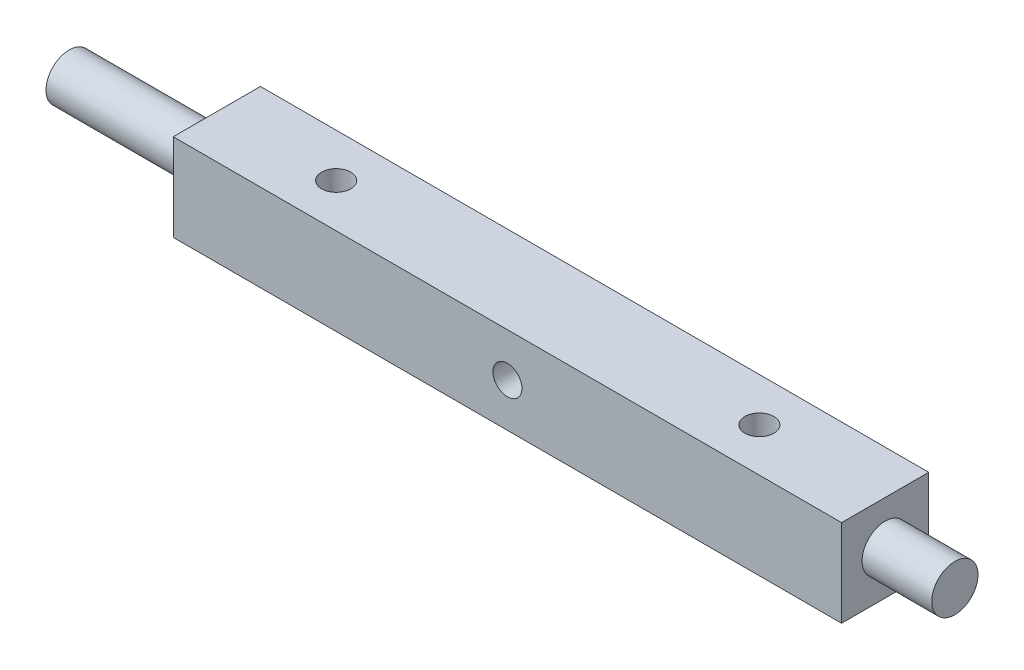
from build123d import *

# Parameters (mm, degrees)
CROQUIS1_W              = 15
CROQUIS1_H              = 15
SALIENTE_EXTRUIR1_DEPTH = 57.5
CROQUIS2_R              = 2.5
CORTAR_EXTRUIR1_DEPTH   = 60.895742754
CROQUIS3_R              = 2.5
CORTAR_EXTRUIR2_DEPTH   = 60.895742754
CROQUIS4_R              = 4
SALIENTE_EXTRUIR2_DEPTH = 25.4
CROQUIS5_R              = 3.976569184
SALIENTE_EXTRUIR3_DEPTH = 12


with BuildPart() as part:
    # Croquis1 → Saliente-Extruir1 (new, symmetric)
    with BuildSketch(Plane(origin=(0, 0, 0), x_dir=(0, 0, -1), z_dir=(1, 0, 0))):
        Rectangle(CROQUIS1_W, CROQUIS1_H)
    extrude(amount=SALIENTE_EXTRUIR1_DEPTH, both=True)

    # Croquis2 → Cortar-Extruir1 (cut, through all)
    with BuildSketch(Plane.XY.offset(7.5)):
        Circle(CROQUIS2_R)
    extrude(amount=-CORTAR_EXTRUIR1_DEPTH, mode=Mode.SUBTRACT)

    # Croquis3 → Cortar-Extruir2 (cut, through all)
    with BuildSketch(Plane(origin=(0, 7.5, 0), x_dir=(1, 0, 0), z_dir=(0, 1, 0))):
        with Locations(Location((-36.974332256, 0, 0), (0, 0, 270))):
            Circle(CROQUIS3_R)
        with Locations(Location((35.85631789, 0, 0), (0, 0, 270))):
            Circle(CROQUIS3_R)
    extrude(amount=-CORTAR_EXTRUIR2_DEPTH, mode=Mode.SUBTRACT)

    # Croquis4 → Saliente-Extruir2 (add)
    with BuildSketch(Plane.ZY.offset(57.5)):
        with Locations(Location((0, 0, 0), (0, 0, 180))):
            Circle(CROQUIS4_R)
    extrude(amount=SALIENTE_EXTRUIR2_DEPTH)

    # Croquis5 → Saliente-Extruir3 (add)
    with BuildSketch(Plane(origin=(57.5, 0, 0), x_dir=(0, 0, -1), z_dir=(1, 0, 0))):
        Circle(CROQUIS5_R)
    extrude(amount=SALIENTE_EXTRUIR3_DEPTH)


solid = part.part
